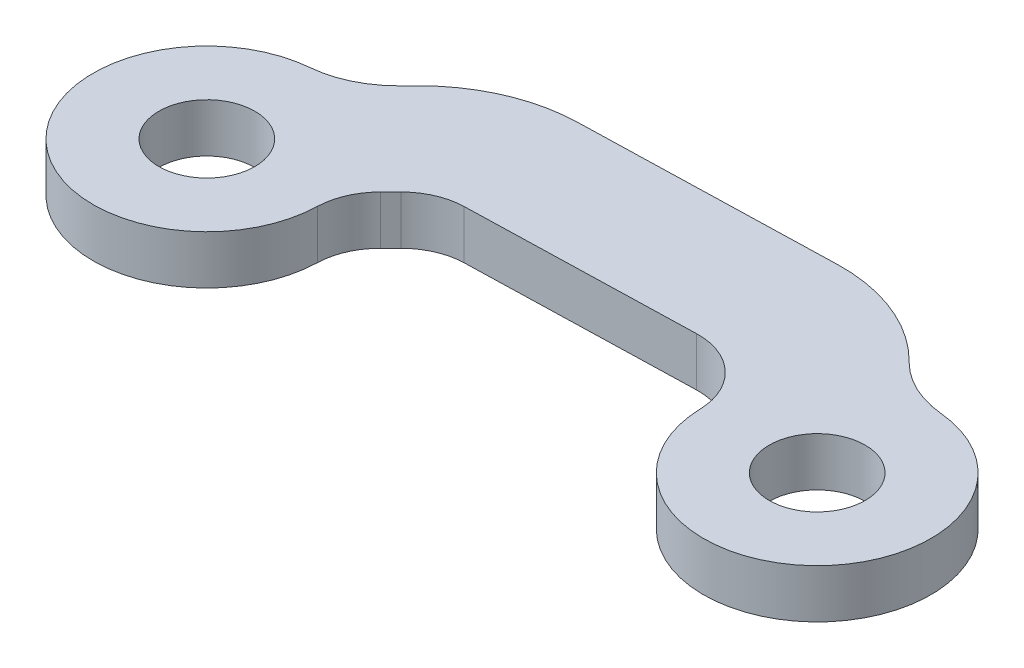
from build123d import *

# Parameters (mm, degrees)
SKETCH1_R           = 1.5
BOSS_EXTRUDE1_DEPTH = 1.524


with BuildPart() as part:
    # Sketch1 → Boss-Extrude1 (new body)
    with BuildSketch(Plane(origin=(0, 0, 0), x_dir=(1, 0, 0), z_dir=(0, 1, 0))):
        with BuildLine():
            Line((14.035300806, 5.461735825), (21.10663358, 5.652076803))
            ThreePointArc((21.10663358, 5.652076803), (21.913592667, 5.50842857), (22.59815065, 5.057653515))
            Line((22.59815065, 5.057653515), (22.609206424, 5.046597741))
            ThreePointArc((22.609206424, 5.046597741), (23.038239741, 4.414453667), (23.203514475, 3.668558246))
            ThreePointArc((23.203514475, 3.668558246), (29.19167252, 1.17868297), (27.085559617, 7.312344528))
            ThreePointArc((27.085559617, 7.312344528), (26.071299756, 7.588172266), (25.211041867, 8.192126215))
            Line((25.211041867, 8.192126215), (25.162863778, 8.240304305))
            ThreePointArc((25.162863778, 8.240304305), (23.45146882, 9.367241942), (21.434071104, 9.726362525))
            Line((21.434071104, 9.726362525), (13.521182629, 9.513369165))
            ThreePointArc((13.521182629, 9.513369165), (11.650868629, 9.101934762), (10.065770406, 8.027310944))
            Line((10.065770406, 8.027310944), (9.730613659, 7.692154197))
            ThreePointArc((9.730613659, 7.692154197), (8.87035577, 7.088200248), (7.856095909, 6.81237251))
            ThreePointArc((7.856095909, 6.81237251), (5.749983006, 0.678710952), (11.738141051, 3.168586228))
            ThreePointArc((11.738141051, 3.168586228), (11.903415785, 3.914481649), (12.332449102, 4.546625723))
            Line((12.332449102, 4.546625723), (12.653135916, 4.867312537))
            ThreePointArc((12.653135916, 4.867312537), (13.287175206, 5.297162064), (14.035300806, 5.461735825))
        make_face()
        with Locations(Location((8.183630247, 3.271488826, 0), (0, 0, 90))):
            Circle(SKETCH1_R, mode=Mode.SUBTRACT)
        with Locations(Location((26.758025279, 3.771460844, 0), (0, 0, 90))):
            Circle(SKETCH1_R, mode=Mode.SUBTRACT)
    extrude(amount=BOSS_EXTRUDE1_DEPTH)


solid = part.part
